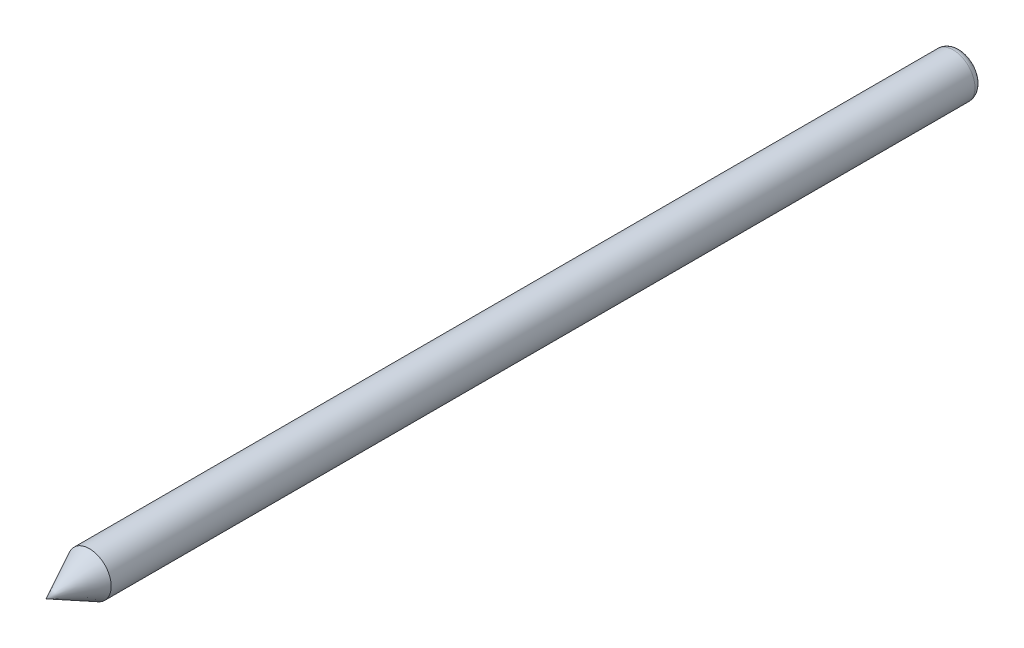
from build123d import *

# Parameters (mm, degrees)
SKETCH1_R           = 3
BOSS_EXTRUDE1_DEPTH = 120
FILLET1_R           = 1


with BuildPart() as part:
    # Sketch1 → Boss-Extrude1 (new body)
    with BuildSketch(Plane.XY):
        Circle(SKETCH1_R)
    extrude(amount=BOSS_EXTRUDE1_DEPTH)

    # Sketch4 → Revolve2 (revolve)
    with BuildSketch(Plane(origin=(0, 0, 0), x_dir=(1, 0, 0), z_dir=(0, 1, 0)), mode=Mode.PRIVATE) as revolve2_sk:
        Polygon((3, -120), (0, -125.982943807), (0, -120), align=None)
    revolve(revolve2_sk.sketch.rotate(Axis((0, 0, 147.90647938), (0, 0, -1)), 180), axis=Axis((0, 0, 147.90647938), (0, 0, -1)))

    # Fillet1
    fillet1_edges = [part.edges().sort_by_distance(p)[0] for p in [
        (-3, 0, 0),
    ]]
    fillet(fillet1_edges, radius=FILLET1_R)


solid = part.part
